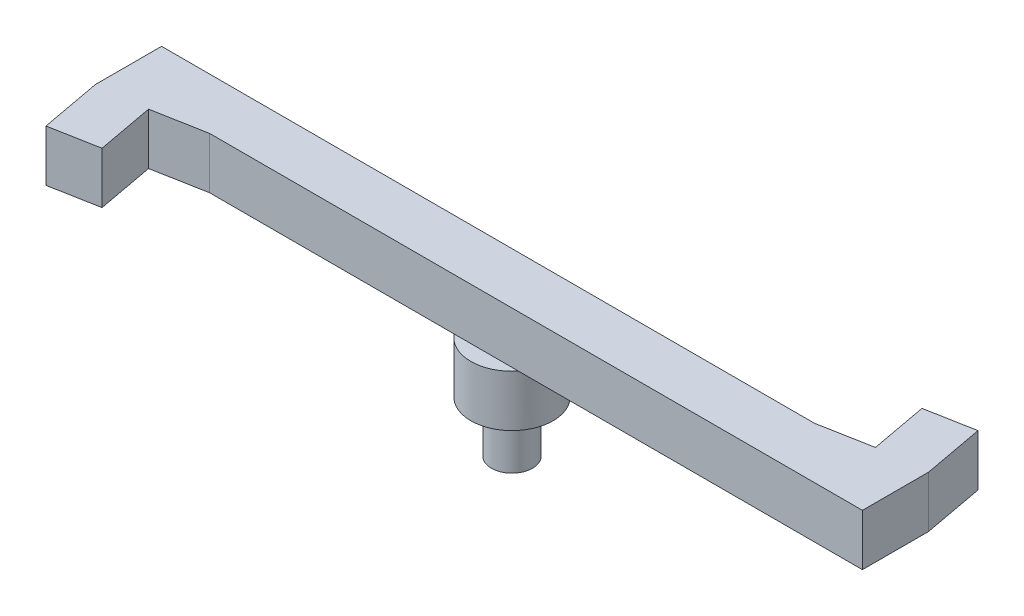
from build123d import *

# Parameters (mm, degrees)
BOSS_EXTRUDE2_DEPTH = 6.35
CIRPATTERN8_COUNT   = 2
SKETCH17_R          = 5.08
BOSS_EXTRUDE3_DEPTH = 6.35
SKETCH18_R          = 2.54
BOSS_EXTRUDE4_DEPTH = 6.35


with BuildPart() as part:
    # Sketch16 → Boss-Extrude2 (new body)
    with BuildSketch(Plane(origin=(0, 0, 0), x_dir=(1, 0, 0), z_dir=(0, 1, 0))):
        Polygon((0, 3.175), (0, -3.175), (46.453207734, -3.175), (46.453207734, 4.99354435), (45.06457303, 12.485946745), (39.226311646, 11.403888956), (40.53332, 4.351902935), (34.18332, 3.175), align=None)
    boss_extrude2 = extrude(amount=BOSS_EXTRUDE2_DEPTH)

    # CirPattern8: Boss-Extrude2 ×2 about axis
    cirpattern8_axis = Axis((0, 11.461697207, 0), (0, -1, 0))
    for i in range(1, CIRPATTERN8_COUNT):
        add(boss_extrude2.rotate(cirpattern8_axis, i * 360 / CIRPATTERN8_COUNT))

    # Sketch17 → Boss-Extrude3 (add)
    with BuildSketch(Plane(origin=(0, 0, 0), x_dir=(1, 0, 0), z_dir=(0, 1, 0))):
        Circle(SKETCH17_R)
    extrude(amount=-BOSS_EXTRUDE3_DEPTH)

    # Sketch18 → Boss-Extrude4 (add)
    with BuildSketch(Plane.XZ.offset(6.35)):
        Circle(SKETCH18_R)
    extrude(amount=BOSS_EXTRUDE4_DEPTH)


solid = part.part
